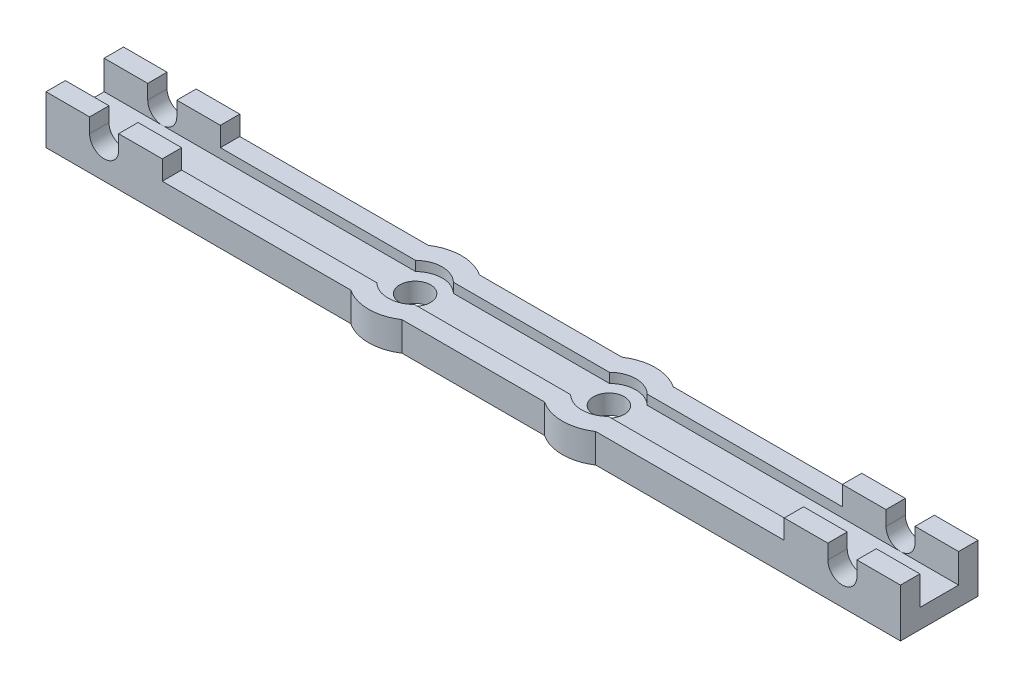
from build123d import *

# Parameters (mm, degrees)
SKETCH1_W           = 44.1
SKETCH1_H           = 8
BOSS_EXTRUDE1_DEPTH = 2
SKETCH2_W           = 12
SKETCH2_H           = 2
BOSS_EXTRUDE2_DEPTH = 3
CUT_EXTRUDE1_DEPTH  = 46.097782651
SKETCH4_W           = 32.1
SKETCH4_H           = 2
BOSS_EXTRUDE3_DEPTH = 1
SKETCH7_R           = 2.794
CUT_EXTRUDE3_DEPTH  = 45.382541613
SKETCH8_R           = 1.5875
CUT_EXTRUDE4_DEPTH  = 45.382541613
BOSS_EXTRUDE4_DEPTH = 3


with BuildPart() as part:
    # Sketch1 → Boss-Extrude1 (new body)
    with BuildSketch(Plane(origin=(0, 0, 0), x_dir=(1, 0, 0), z_dir=(0, 1, 0))):
        with Locations((22.05, 0)):
            Rectangle(SKETCH1_W, SKETCH1_H)
    boss_extrude1 = extrude(amount=BOSS_EXTRUDE1_DEPTH)

    # Sketch2 → Boss-Extrude2 (add)
    with BuildSketch(Plane(origin=(0, 2, 0), x_dir=(1, 0, 0), z_dir=(0, 1, 0))):
        with Locations((38.1, 3)):
            Rectangle(SKETCH2_W, SKETCH2_H)
        with Locations((38.1, -3)):
            Rectangle(SKETCH2_W, SKETCH2_H)
    boss_extrude2 = extrude(amount=BOSS_EXTRUDE2_DEPTH)

    # Sketch3 → Cut-Extrude1 (cut, through all)
    with BuildSketch(Plane.XY.offset(4)):
        with BuildLine():
            Line((36.6, 3.5), (36.6, 5))
            Line((36.6, 5), (39.6, 5))
            Line((39.6, 5), (39.6, 3.5))
            ThreePointArc((39.6, 3.5), (38.1, 2), (36.6, 3.5))
        make_face()
    cut_extrude1 = extrude(amount=-CUT_EXTRUDE1_DEPTH, mode=Mode.SUBTRACT)

    # Sketch4 → Boss-Extrude3 (add)
    with BuildSketch(Plane(origin=(0, 2, 0), x_dir=(1, 0, 0), z_dir=(0, 1, 0))):
        with Locations((16.05, -3)):
            Rectangle(SKETCH4_W, SKETCH4_H)
        with Locations((16.05, 3)):
            Rectangle(SKETCH4_W, SKETCH4_H)
    boss_extrude3 = extrude(amount=BOSS_EXTRUDE3_DEPTH)

    # Mirror1: Boss-Extrude1, Boss-Extrude2, Cut-Extrude1, Boss-Extrude3 across plane
    add(boss_extrude1.mirror(Plane(origin=(0, 0, 0), x_dir=(0, 0, 1), z_dir=(1, 0, 0))))
    add(boss_extrude2.mirror(Plane(origin=(0, 0, 0), x_dir=(0, 0, 1), z_dir=(1, 0, 0))))
    add(cut_extrude1.mirror(Plane(origin=(0, 0, 0), x_dir=(0, 0, 1), z_dir=(1, 0, 0))), mode=Mode.SUBTRACT)
    add(boss_extrude3.mirror(Plane(origin=(0, 0, 0), x_dir=(0, 0, 1), z_dir=(1, 0, 0))))

    # Sketch7 → Cut-Extrude3 (cut, through all)
    with BuildSketch(Plane(origin=(0, 2, 0), x_dir=(1, 0, 0), z_dir=(0, 1, 0))):
        with Locations((10, 0)):
            Circle(SKETCH7_R)
    cut_extrude3 = extrude(amount=CUT_EXTRUDE3_DEPTH, mode=Mode.SUBTRACT)

    # Sketch8 → Cut-Extrude4 (cut, through all)
    with BuildSketch(Plane(origin=(0, 2, 0), x_dir=(1, 0, 0), z_dir=(0, 1, 0))):
        with Locations(Location((10, 0, 0), (0, 0, 270))):
            Circle(SKETCH8_R)
    cut_extrude4 = extrude(amount=-CUT_EXTRUDE4_DEPTH, mode=Mode.SUBTRACT)

    # Sketch9 → Boss-Extrude4 (add)
    with BuildSketch(Plane(origin=(0, 3, 0), x_dir=(1, 0, 0), z_dir=(0, 1, 0))):
        with BuildLine():
            Line((12.642429942, 4), (7.357570058, 4))
            ThreePointArc((7.357570058, 4), (10, 4.794), (12.642429942, 4))
        make_face()
        with BuildLine():
            Line((7.357570058, -4), (12.642429942, -4))
            ThreePointArc((12.642429942, -4), (10, -4.794), (7.357570058, -4))
        make_face()
    boss_extrude4 = extrude(amount=-BOSS_EXTRUDE4_DEPTH)

    # Mirror2: Cut-Extrude3, Cut-Extrude4, Boss-Extrude4 across plane
    add(cut_extrude3.mirror(Plane(origin=(0, 0, 0), x_dir=(0, 0, 1), z_dir=(1, 0, 0))), mode=Mode.SUBTRACT)
    add(cut_extrude4.mirror(Plane(origin=(0, 0, 0), x_dir=(0, 0, 1), z_dir=(1, 0, 0))), mode=Mode.SUBTRACT)
    add(boss_extrude4.mirror(Plane(origin=(0, 0, 0), x_dir=(0, 0, 1), z_dir=(1, 0, 0))))


solid = part.part
